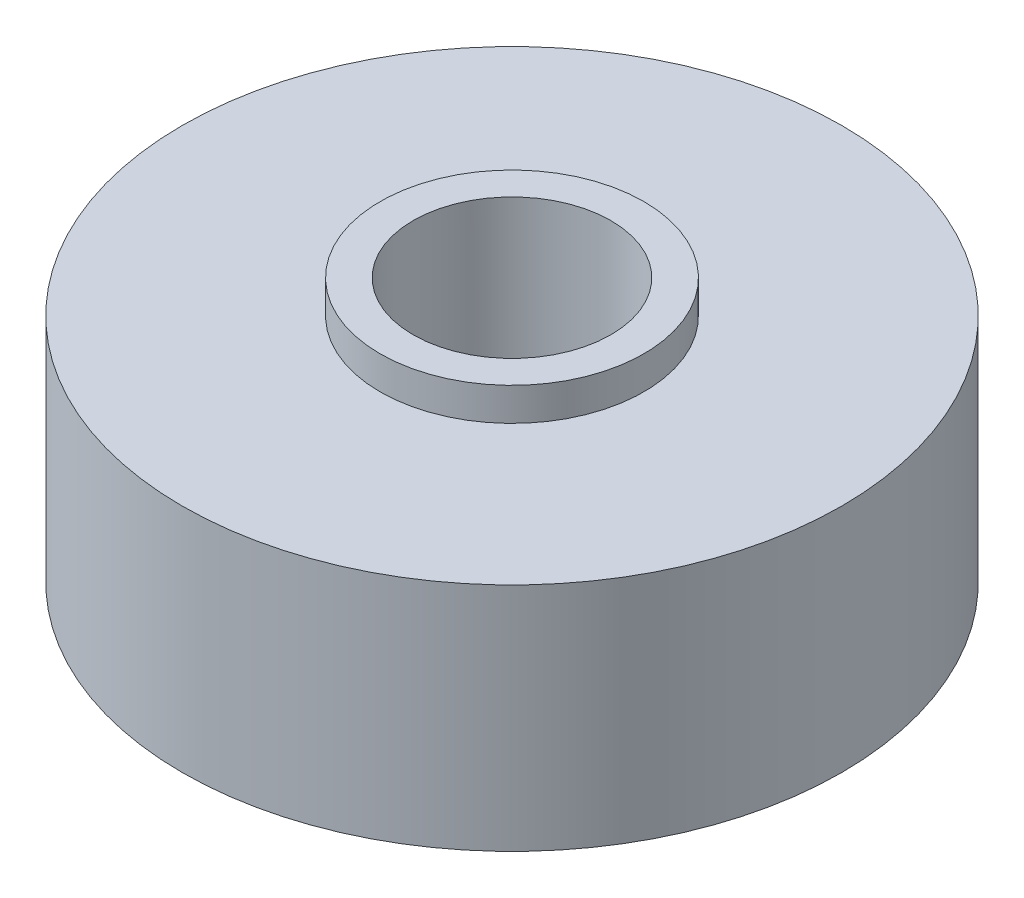
from build123d import *

# Parameters (mm, degrees)
SKETCH1_R           = 10
BOSS_EXTRUDE1_DEPTH = 7
SKETCH2_R           = 4
SKETCH2_R_2         = 3
BOSS_EXTRUDE2_DEPTH = 1
CUT_EXTRUDE2_START  = -8
SKETCH4_R           = 3
CUT_EXTRUDE2_DEPTH  = 8
BOSS_EXTRUDE3_START = 1
SKETCH5_R           = 4
SKETCH5_R_2         = 3
BOSS_EXTRUDE3_DEPTH = 1


with BuildPart() as part:
    # Sketch1 → Boss-Extrude1 (new body)
    with BuildSketch(Plane(origin=(0, 0, 0), x_dir=(1, 0, 0), z_dir=(0, 1, 0))):
        with Locations(Location((0, 0, 0), (0, 0, 270))):
            Circle(SKETCH1_R)
    extrude(amount=BOSS_EXTRUDE1_DEPTH)

    # Sketch2 → Boss-Extrude2 (add)
    with BuildSketch(Plane(origin=(0, 7, 0), x_dir=(1, 0, 0), z_dir=(0, 1, 0))):
        with Locations(Location((0, 0, 0), (0, 0, 270))):
            Circle(SKETCH2_R)
        with Locations(Location((0, 0, 0), (0, 0, 270))):
            Circle(SKETCH2_R_2, mode=Mode.SUBTRACT)
    extrude(amount=BOSS_EXTRUDE2_DEPTH)

    # Sketch4 → Cut-Extrude2 (cut)
    with BuildSketch(Plane(origin=(0, 7, 0), x_dir=(1, 0, 0), z_dir=(0, 1, 0)).offset(CUT_EXTRUDE2_START)):
        with Locations(Location((0, 0, 0), (0, 0, 270))):
            Circle(SKETCH4_R)
    extrude(amount=CUT_EXTRUDE2_DEPTH, mode=Mode.SUBTRACT)

    # Sketch5 → Boss-Extrude3 (add)
    with BuildSketch(Plane.XZ.offset(BOSS_EXTRUDE3_START)):
        with Locations(Location((0, 0, 0), (0, 0, 90))):
            Circle(SKETCH5_R)
        with Locations(Location((0, 0, 0), (0, 0, 270))):
            Circle(SKETCH5_R_2, mode=Mode.SUBTRACT)
    extrude(amount=-BOSS_EXTRUDE3_DEPTH)


solid = part.part
